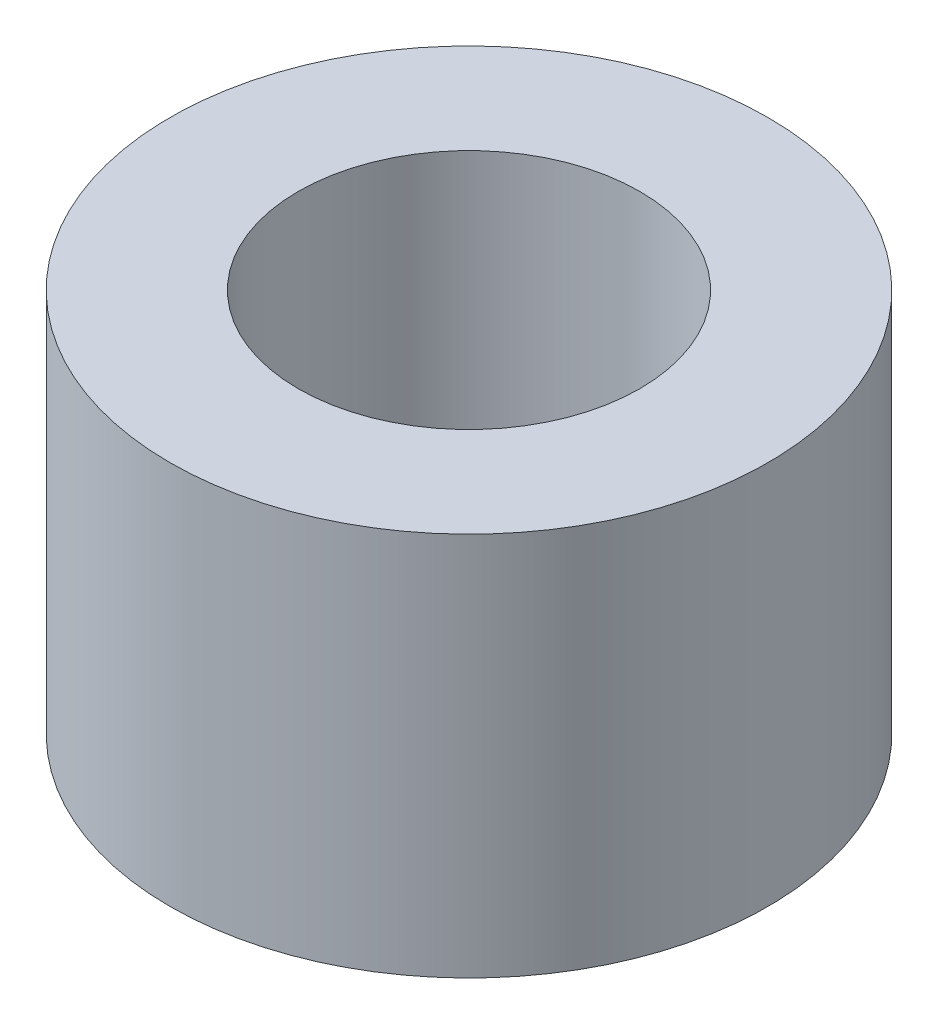
from build123d import *

# Parameters (mm, degrees)
CROQUIS1_R              = 7
CROQUIS1_R_2            = 4
SALIENTE_EXTRUIR1_DEPTH = 9


with BuildPart() as part:
    # Croquis1 → Saliente-Extruir1 (new body)
    with BuildSketch(Plane(origin=(0, 0, 0), x_dir=(1, 0, 0), z_dir=(0, 1, 0))):
        with Locations(Location((0, 0, 0), (0, 0, 270))):
            Circle(CROQUIS1_R)
        with Locations(Location((0, 0, 0), (0, 0, 270))):
            Circle(CROQUIS1_R_2, mode=Mode.SUBTRACT)
    extrude(amount=SALIENTE_EXTRUIR1_DEPTH)


solid = part.part
